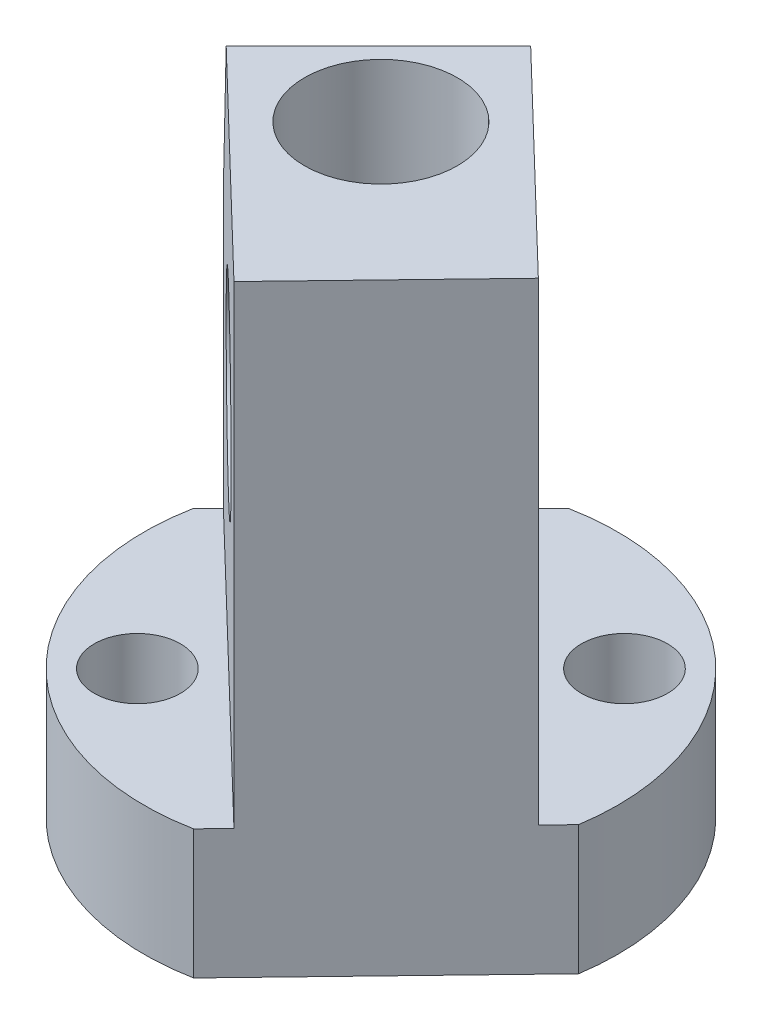
from build123d import *

# Parameters (mm, degrees)
ESQUISSE1_W                                        = 11
ESQUISSE1_H                                        = 6
BOSS_EXTRU_1_DEPTH                                 = 22
DIAM_TRE_DU_PER_AGE_7_1_7_1_1_D                    = 7.1
DIAM_TRE_DU_PER_AGE_7_1_7_1_1_DEPTH                = 6
DIAM_TRE_DU_PER_AGE_8_5_8_5_1_D                    = 8.5
CHAMBRAGE_POUR_VIS_T_TE_HEXAGONALE_M21_D           = 2.5
CHAMBRAGE_POUR_VIS_T_TE_HEXAGONALE_M21_CBORE_D     = 4
CHAMBRAGE_POUR_VIS_T_TE_HEXAGONALE_M21_CBORE_DEPTH = 4.5
DIAM_TRE_DU_PER_AGE_8_0_8_1_D                      = 8
DIAM_TRE_DU_PER_AGE_8_0_8_1_DEPTH                  = 2
DIAM_TRE_DU_PER_AGE_8_0_8_1_TIP                    = 4
CHANFREIN1_SIZE                                    = 9
CHANFREIN1_SIZE2                                   = 4.785384885
ENL_V_MAT_EXTRU_1_DEPTH                            = 10


with BuildPart() as part:
    # Esquisse1 → Révolution1 (revolve)
    with BuildSketch(Plane(origin=(0, 0, 0), x_dir=(-1, 0, 0), z_dir=(0, 0, -1)), mode=Mode.PRIVATE) as r_volution1_sk:
        with Locations((-5.5, 3)):
            Rectangle(ESQUISSE1_W, ESQUISSE1_H)
    revolve(r_volution1_sk.sketch.rotate(Axis((0, 0, 0), (0, 1, 0)), 270), axis=Axis((0, 0, 0), (0, 1, 0)))

    # Esquisse2 → Boss.-Extru.1 (add)
    with BuildSketch(Plane(origin=(0, 6, 0), x_dir=(-1, 0, 0), z_dir=(0, 1, 0))):
        Polygon((-9.95156463, 2.63938656), (-3.016441782, 9.843834567), (10.088792211, -2.771484138), (3.016441782, -9.843834567), align=None)
    extrude(amount=BOSS_EXTRU_1_DEPTH)

    # Diamètre du perçage Ø7.1 (7.1)1
    with Locations(Plane(origin=(0, 28, 0), x_dir=(1, 0, 0), z_dir=(0, 1, 0))):
        with Locations((0, 0)):
            Hole(DIAM_TRE_DU_PER_AGE_7_1_7_1_1_D / 2, depth=DIAM_TRE_DU_PER_AGE_7_1_7_1_1_DEPTH)

    # Diamètre du perçage Ø8.5 (8.5)1 (through all)
    with Locations(Plane(origin=(-3.467561424, 0, 3.602224003), x_dir=(0.7204448006982934, 0, 0.6935122847843406), z_dir=(-0.6935122847843406, 0, 0.7204448006982934))):
        with Locations((-0.19047619, 17)):
            Hole(DIAM_TRE_DU_PER_AGE_8_5_8_5_1_D / 2)

    # Chambrage pour vis à tête hexagonale M21 (through all)
    with Locations(Plane(origin=(0, 6, 0), x_dir=(1, 0, 0), z_dir=(0, 1, 0))):
        with Locations((5.656854249, 5.656854249), (-5.656854249, -5.656854249)):
            CounterBoreHole(CHAMBRAGE_POUR_VIS_T_TE_HEXAGONALE_M21_D / 2, CHAMBRAGE_POUR_VIS_T_TE_HEXAGONALE_M21_CBORE_D / 2, CHAMBRAGE_POUR_VIS_T_TE_HEXAGONALE_M21_CBORE_DEPTH)

    # Diamètre du perçage Ø8.0 (8)1
    with Locations(Plane(origin=(0, 0, 0), x_dir=(-1, 0, 0), z_dir=(0, -1, 0))):
        with Locations((0, 0)):
            Hole(DIAM_TRE_DU_PER_AGE_8_0_8_1_D / 2, depth=DIAM_TRE_DU_PER_AGE_8_0_8_1_DEPTH)
            with Locations((0, 0, -(DIAM_TRE_DU_PER_AGE_8_0_8_1_DEPTH + DIAM_TRE_DU_PER_AGE_8_0_8_1_TIP / 2))):  # 90° drill point
                Cone(0, DIAM_TRE_DU_PER_AGE_8_0_8_1_D / 2, DIAM_TRE_DU_PER_AGE_8_0_8_1_TIP, mode=Mode.SUBTRACT)

    # Chanfrein1
    chanfrein1_edges = [part.edges().sort_by_distance(p)[0] for p in [
        (-6.552616997, 28, -6.307659352),
    ]]
    chanfrein1_side = [part.faces().sort_by_distance(p)[0] for p in [
        (-6.552616997, 17, -6.307659352),
    ]]
    chamfer(chanfrein1_edges, length=CHANFREIN1_SIZE, length2=CHANFREIN1_SIZE2, reference=chanfrein1_side[0])

    # Esquisse11 → Enlèv. mat.-Extru.1 (cut)
    with BuildSketch(Plane(origin=(0, 6, 0), x_dir=(1, 0, 0), z_dir=(0, 1, 0))):
        Polygon((1.20429729, -11.726353602), (11.620583405, -0.905551522), (15.545873169, -4.684101481), (5.129587053, -15.504903562), align=None)
        Polygon((0.545569668, 13.405846017), (-12.47793973, 0.382336619), (-16.03995118, 3.944348069), (-3.016441782, 16.967857467), align=None)
    extrude(amount=-ENL_V_MAT_EXTRU_1_DEPTH, mode=Mode.SUBTRACT)


solid = part.part
